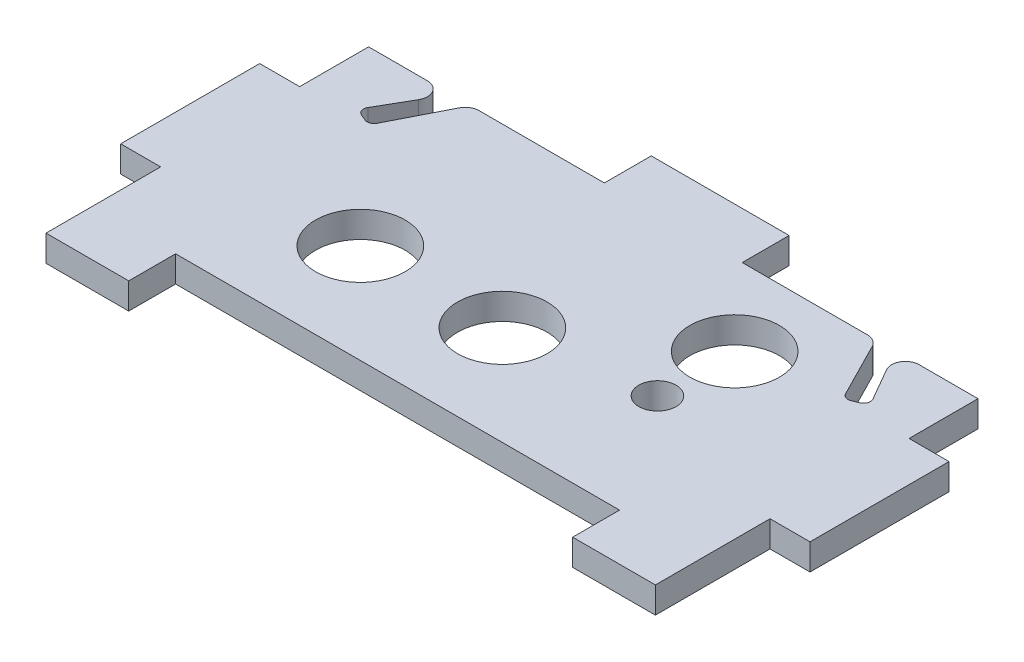
from build123d import *

# Parameters (mm, degrees)
BOSS_EXTRUDE1_DEPTH = 4.826
FILLET1_R           = 1.27
SKETCH2_R           = 8.255
SKETCH2_R_2         = 3.429
CUT_EXTRUDE1_DEPTH  = 75.015290562
FILLET2_R           = 2.54


with BuildPart() as part:
    # Sketch1 → Boss-Extrude1 (new body)
    with BuildSketch(Plane(origin=(0, 0, 0), x_dir=(1, 0, 0), z_dir=(0, 1, 0))):
        Polygon((-56.134, 29.083), (-40.894, 29.083), (-47.241885042, 18.083256572), (-43.685885042, 16.624574128), (-37.338, 29.083), (-12.7, 29.083), (-12.7, 37.719), (12.7, 37.719), (12.7, 29.083), (37.338, 29.083), (43.685885042, 16.624574128), (47.241885042, 18.083256572), (40.894, 29.083), (56.134, 29.083), (56.134, 16.383), (63.5, 16.383), (63.5, -9.230617291), (56.134, -9.230617291), (56.134, -29.083), (56.134, -30.353), (40.894, -30.353), (40.894, -21.717), (-40.894, -21.717), (-40.894, -30.353), (-56.134, -30.353), (-56.134, -29.083), (-56.134, -9.230617291), (-63.5, -9.230617291), (-63.5, 16.383), (-56.134, 16.383), align=None)
    extrude(amount=BOSS_EXTRUDE1_DEPTH)

    # Fillet1
    fillet1_edges = [part.edges().sort_by_distance(p)[0] for p in [
        (-47.241885042, 2.413, -18.083256572),
        (-43.685885042, 2.413, -16.624574128),
        (43.685885042, 2.413, -16.624574128),
        (47.241885042, 2.413, -18.083256572),
    ]]
    fillet(fillet1_edges, radius=FILLET1_R)

    # Sketch2 → Cut-Extrude1 (cut, through all)
    with BuildSketch(Plane(origin=(0, 4.826, 0), x_dir=(1, 0, 0), z_dir=(0, 1, 0))):
        with Locations(Location((26.162, 14.224, 0), (0, 0, 270))):
            Circle(SKETCH2_R)
        with Locations(Location((26.162, 0, 0), (0, 0, 270))):
            Circle(SKETCH2_R_2)
        with Locations(Location((-25.146, -3.429, 0), (0, 0, 270))):
            Circle(SKETCH2_R)
        with Locations(Location((1.016, -3.429, 0), (0, 0, 270))):
            Circle(SKETCH2_R)
    extrude(amount=-CUT_EXTRUDE1_DEPTH, mode=Mode.SUBTRACT)

    # Fillet2
    fillet2_edges = [part.edges().sort_by_distance(p)[0] for p in [
        (-40.894, 2.413, -29.083),
        (-37.338, 2.413, -29.083),
        (37.338, 2.413, -29.083),
        (40.894, 2.413, -29.083),
    ]]
    fillet(fillet2_edges, radius=FILLET2_R)


solid = part.part
